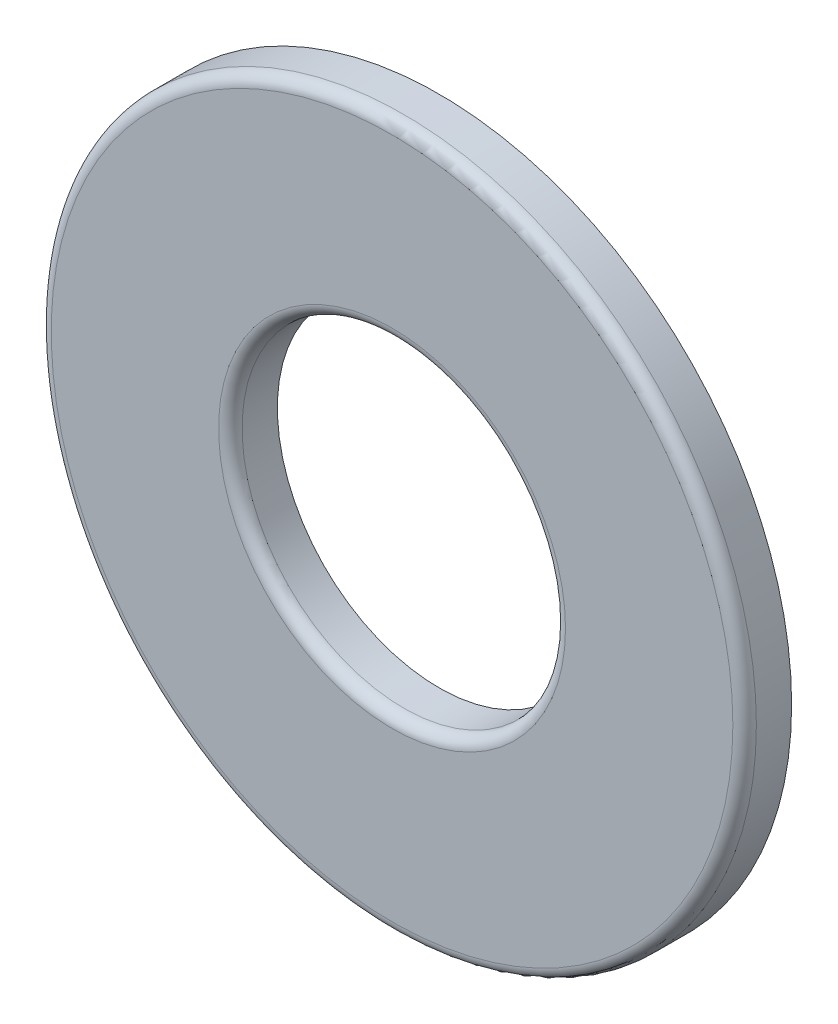
from build123d import *

# Parameters (mm, degrees)
BOSS_EXTRUDE1_DEPTH      = 0.635
BOSS_EXTRUDE1_DEPTH_BACK = 0.635
SKETCH3_R                = 9.525
SKETCH3_R_2              = 4.3688
FILLET1_R                = 0.3175


with BuildPart() as part:
    # Sketch3 → Boss-Extrude1 (new, two sides: drawn at the far end of the back side and taken through both)
    with BuildSketch(Plane.XY.offset(-BOSS_EXTRUDE1_DEPTH_BACK)):
        Circle(SKETCH3_R)
        Circle(SKETCH3_R_2, mode=Mode.SUBTRACT)
    extrude(amount=BOSS_EXTRUDE1_DEPTH + BOSS_EXTRUDE1_DEPTH_BACK)

    # Fillet1
    fillet1_edges = [part.edges().sort_by_distance(p)[0] for p in [
        (-9.525, 0, 0.635),
        (-4.3688, 0, 0.635),
    ]]
    fillet(fillet1_edges, radius=FILLET1_R)


solid = part.part
